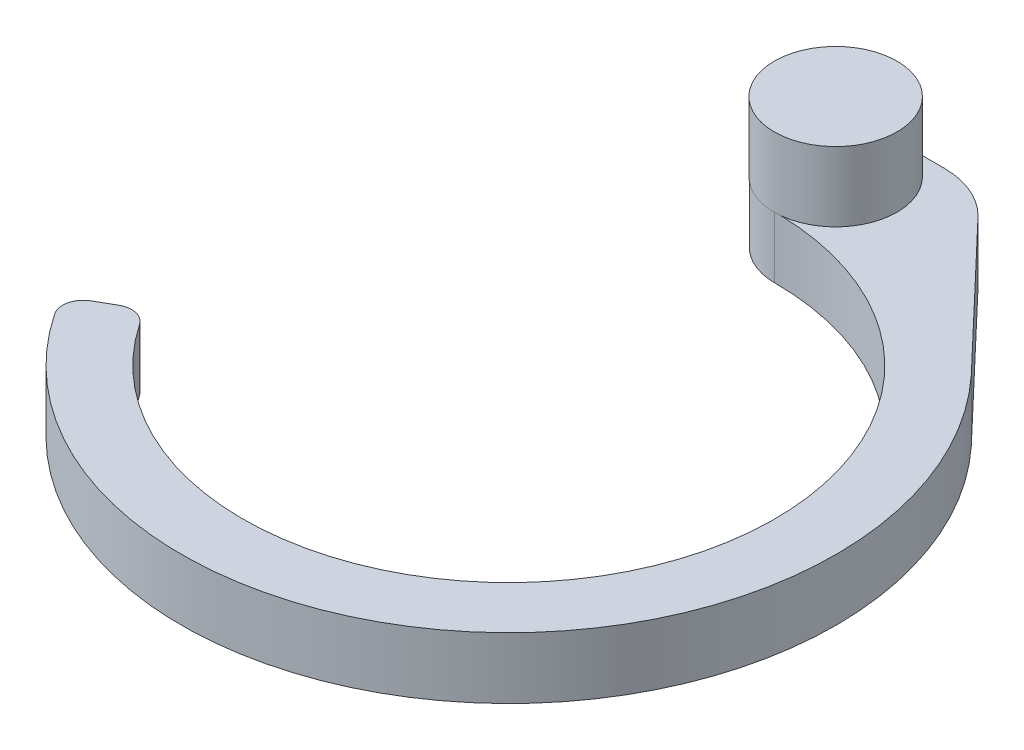
from build123d import *

# Parameters (mm, degrees)
EXTRUDE_4_DEPTH = 15
SKETCH_10_R     = 15
EXTRUDE_5_DEPTH = 17


with BuildPart() as part:
    # ｽｹｯﾁ2 → ﾎﾞｽ - 押し出し4 (new body)
    with BuildSketch(Plane(origin=(0, 0, 0), x_dir=(1, 0, 0), z_dir=(0, 1, 0))):
        with BuildLine():
            ThreePointArc((-53.82643789, -36.437818048), (-56.846261527, -34.367935813), (-60.466933112, -34.910600109))
            Line((-60.466933112, -34.910600109), (-64.807406984, -37.416573868))
            ThreePointArc((-64.807406984, -37.416573868), (-67.177509772, -40.614402853), (-66.461234116, -44.529814279))
            ThreePointArc((-66.461234116, -44.529814279), (49.665387485, -62.716419588), (58.57572973, 54.487465409))
            Line((58.57572973, 54.487465409), (57.289371136, 55.838409315))
            Line((57.289371136, 55.838409315), (25.911523347, 88.791671712))
            ThreePointArc((25.911523347, 88.791671712), (19.306695871, 93.382511176), (11.427401304, 95))
            Line((11.427401304, 95), (0, 95))
            ThreePointArc((0, 95), (-15, 80), (0, 65))
            ThreePointArc((0, 65), (57.41714976, -30.467538684), (-53.82643789, -36.437818048))
        make_face()
    extrude(amount=EXTRUDE_4_DEPTH)

    # ｽｹｯﾁ10 → ﾎﾞｽ - 押し出し5 (add)
    with BuildSketch(Plane(origin=(0, 15, 0), x_dir=(1, 0, 0), z_dir=(0, 1, 0))):
        with Locations(Location((0, 79.906692584, 0), (0, 0, 179.821795675))):
            Circle(SKETCH_10_R)
    extrude(amount=EXTRUDE_5_DEPTH)


solid = part.part
